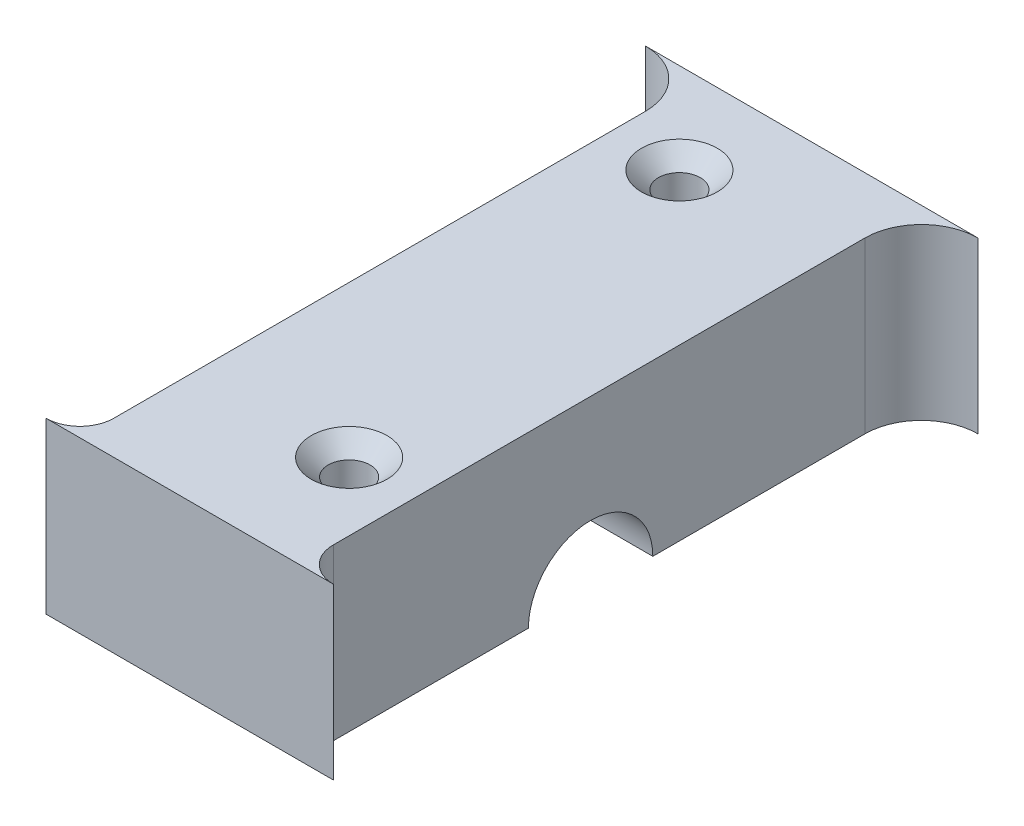
from build123d import *

# Parameters (mm, degrees)
CORPO_DEPTH                           = 15
ENCAIXE_FLANGE_11_PASSANTE_DEPTH      = 59.873508474
ENCAIXE_FLANGE_11_PASSANTE_DEPTH_BACK = 59.873508474
ESBO_O3_R                             = 5.5
ENCAIXE_FLANGE_23X4_DEPTH             = 2
ENCAIXE_FLANGE_23X4_DEPTH_BACK        = 2
ESBO_O4_R                             = 11.5
ESBO_O6_R                             = 1.85
FUROS_DE_FIXA_O_DEPTH                 = 64.251561246
ESCAREADO_1_5X45_SIZE                 = 1.5


with BuildPart() as part:
    # Esboço1 → Corpo (new body)
    with BuildSketch(Plane(origin=(0, 0, 0), x_dir=(1, 0, 0), z_dir=(0, 1, 0))):
        with BuildLine():
            Line((3, 50), (3, 3))
            ThreePointArc((3, 3), (2.121320344, 0.878679656), (0, 0))
            Line((0, 0), (25.4, 0))
            ThreePointArc((25.4, 0), (23.278679656, 0.878679656), (22.4, 3))
            Line((22.4, 3), (22.4, 50))
            ThreePointArc((22.4, 50), (23.864466094, 53.535533906), (27.4, 55))
            Line((27.4, 55), (-2, 55))
            ThreePointArc((-2, 55), (1.535533906, 53.535533906), (3, 50))
        make_face()
    extrude(amount=CORPO_DEPTH)

    # Esboço3 → Encaixe Flange - Ø11 Passante (cut, two sides: drawn at the far end of the back side and taken through both)
    with BuildSketch(Plane(origin=(12.7, 0, 0), x_dir=(0, 0, -1), z_dir=(1, 0, 0)).offset(-ENCAIXE_FLANGE_11_PASSANTE_DEPTH_BACK)):
        with Locations((25.75, 0)):
            Circle(ESBO_O3_R)
    extrude(amount=ENCAIXE_FLANGE_11_PASSANTE_DEPTH + ENCAIXE_FLANGE_11_PASSANTE_DEPTH_BACK, mode=Mode.SUBTRACT)

    # Esboço4 → Encaixe Flange - Ø23x4 (cut, two sides: drawn at the far end of the back side and taken through both)
    with BuildSketch(Plane(origin=(12.7, 0, 0), x_dir=(0, 0, -1), z_dir=(1, 0, 0)).offset(-ENCAIXE_FLANGE_23X4_DEPTH_BACK)):
        with Locations((25.75, 0)):
            Circle(ESBO_O4_R)
    extrude(amount=ENCAIXE_FLANGE_23X4_DEPTH + ENCAIXE_FLANGE_23X4_DEPTH_BACK, mode=Mode.SUBTRACT)

    # Esboço6 → Furos de Fixação (cut, through all)
    with BuildSketch(Plane.XZ):
        with Locations(Location((16.4, -10.4, 0), (0, 0, 270))):
            Circle(ESBO_O6_R)
        with Locations(Location((9, -47, 0), (0, 0, 270))):
            Circle(ESBO_O6_R)
    extrude(amount=-FUROS_DE_FIXA_O_DEPTH, mode=Mode.SUBTRACT)

    # Escareado 1.5x45°
    escareado_1_5x45_edges = [part.edges().sort_by_distance(p)[0] for p in [
        (16.4, 15, -8.55),
        (9, 15, -45.15),
    ]]
    chamfer(escareado_1_5x45_edges, length=ESCAREADO_1_5X45_SIZE)


solid = part.part
